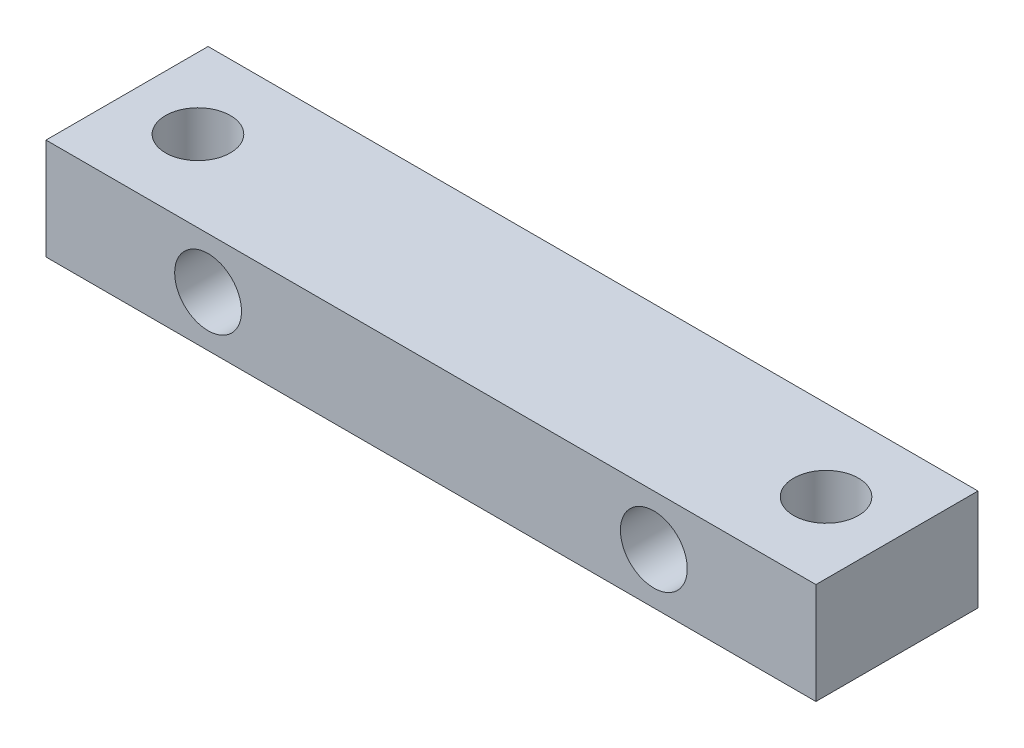
from build123d import *

# Parameters (mm, degrees)
CROQUIS1_W                          = 38
CROQUIS1_H                          = 5
SALIENTE_EXTRUIR1_DEPTH             = 8
DI_METRO_DE_TALADRO_3_2_3_2_1_D     = 3.2
DI_METRO_DE_TALADRO_3_2_3_2_1_DEPTH = 12
DI_METRO_DE_TALADRO_3_2_3_2_1_TIP   = 0.96137699
TALADRO_ROSCADO_M41_D               = 3.3


with BuildPart() as part:
    # Croquis1 → Saliente-Extruir1 (new body)
    with BuildSketch(Plane.XY):
        with Locations((19, 2.5)):
            Rectangle(CROQUIS1_W, CROQUIS1_H)
    extrude(amount=SALIENTE_EXTRUIR1_DEPTH)

    # Diámetro de taladro Ø3.2 (3.2)1
    with Locations(Plane(origin=(3.5, 5, 4), x_dir=(0, 0, 1), z_dir=(0, 1, 0))):
        with Locations((0, 0), (0, 31)):
            Hole(DI_METRO_DE_TALADRO_3_2_3_2_1_D / 2, depth=DI_METRO_DE_TALADRO_3_2_3_2_1_DEPTH)
            with Locations((0, 0, -(DI_METRO_DE_TALADRO_3_2_3_2_1_DEPTH + DI_METRO_DE_TALADRO_3_2_3_2_1_TIP / 2))):  # 118° drill point
                Cone(0, DI_METRO_DE_TALADRO_3_2_3_2_1_D / 2, DI_METRO_DE_TALADRO_3_2_3_2_1_TIP, mode=Mode.SUBTRACT)

    # Taladro roscado M41 (through all)
    with Locations(Plane(origin=(8, 2.5, 0), x_dir=(-1, 0, 0), z_dir=(0, 0, -1))):
        with Locations((0, 0), (-22, 0)):
            Hole(TALADRO_ROSCADO_M41_D / 2)


solid = part.part
